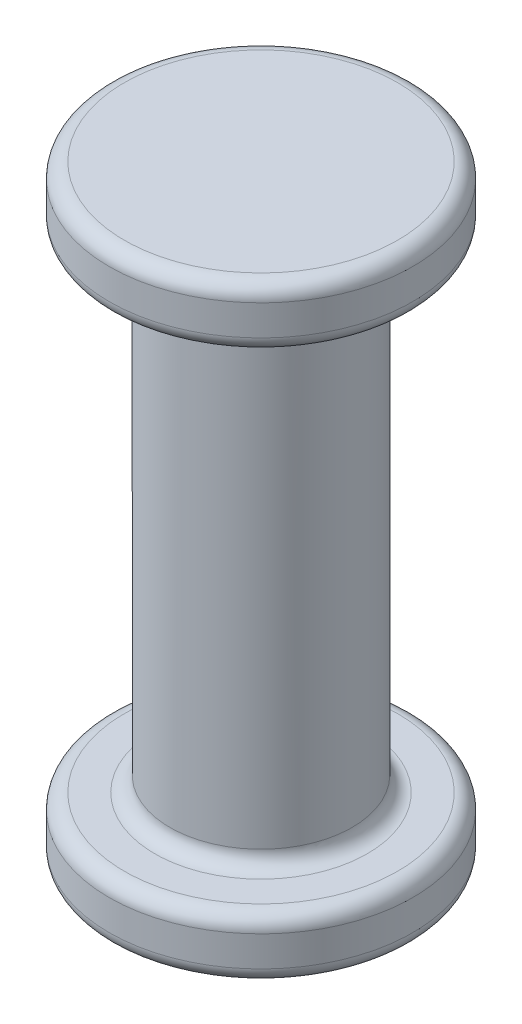
from build123d import *

# Parameters (mm, degrees)
FILLET1_R = 0.25


with BuildPart() as part:
    # Sketch2 → Revolve1 (revolve)
    with BuildSketch(Plane.XY, mode=Mode.PRIVATE) as revolve1_sk:
        Polygon((-2.5, 1), (-2.5, 0), (0, 0), (0, 10), (-2.5, 10), (-2.5, 9), (-1.5, 9), (-1.5, 1), align=None)
    revolve(revolve1_sk.sketch.rotate(Axis((0, 0, 0), (0, 1, 0)), 270), axis=Axis((0, 0, 0), (0, 1, 0)))

    # Fillet1
    fillet1_edges = [part.edges().sort_by_distance(p)[0] for p in [
        (0, 0, 2.5),
        (0, 1, 2.5),
        (0, 1, 1.5),
        (0, 9, 1.5),
        (0, 9, 2.5),
        (0, 10, 2.5),
    ]]
    fillet(fillet1_edges, radius=FILLET1_R)


solid = part.part
